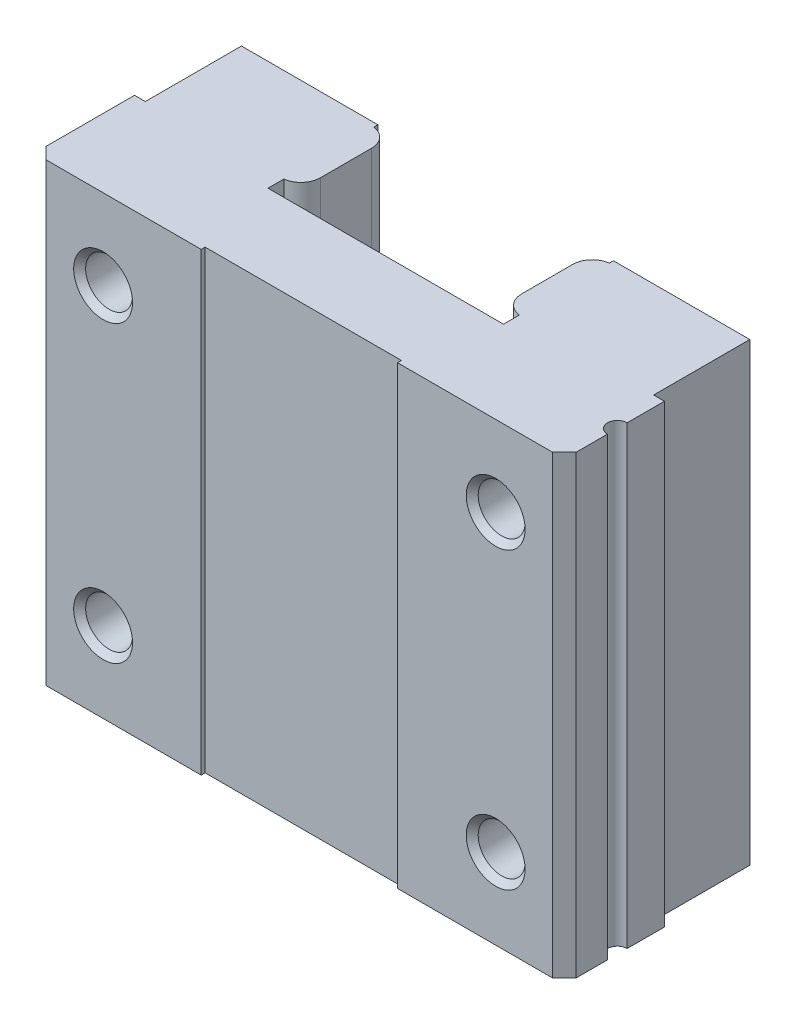
from build123d import *

# Parameters (mm, degrees)
CROQUIS1_W                    = 27
CROQUIS1_H                    = 23.199
SALIENTE_EXTRUIR1_DEPTH       = 10
CORTAR_EXTRUIR1_DEPTH         = 30.823541054
CROQUIS3_W                    = 0.55
CROQUIS3_H                    = 4.9
CORTAR_EXTRUIR2_DEPTH         = 30.823541054
CORTAR_EXTRUIR3_DEPTH         = 30.823541054
CORTAR_EXTRUIR4_DEPTH         = 23.199
CROQUIS6_W                    = 0.55
CROQUIS6_H                    = 4.9
CORTAR_EXTRUIR5_DEPTH         = 30.823541054
CROQUIS7_W                    = 10
CROQUIS7_H                    = 0.2
CORTAR_EXTRUIR6_DEPTH         = 30.823541054
DI_METRO_DE_TALADRO_1_0_1_1_D = 1
CHAFL_N1_SIZE                 = 0.305
CHAFL_N2_SIZE                 = 0.6


with BuildPart() as part:
    # Croquis1 → Saliente-Extruir1 (new body)
    with BuildSketch(Plane.XY.offset(13)):
        with Locations((0, 74.9)):
            Rectangle(CROQUIS1_W, CROQUIS1_H)
    extrude(amount=-SALIENTE_EXTRUIR1_DEPTH)

    # Croquis2 → Cortar-Extruir1 (cut, through all)
    with BuildSketch(Plane.XZ.offset(-63.3005)):
        with BuildLine():
            Line((-5.125, 3), (5.125, 3))
            Line((5.125, 3), (5.125, 6.799999997))
            ThreePointArc((5.125, 6.799999997), (5.375, 7.461437825), (6, 7.79215674))
            Line((6, 7.79215674), (6, 8.6))
            Line((6, 8.6), (-6, 8.6))
            Line((-6, 8.6), (-6, 7.79215674))
            ThreePointArc((-6, 7.79215674), (-5.375, 7.461437828), (-5.125, 6.800000001))
            Line((-5.125, 6.800000001), (-5.125, 3))
        make_face()
    extrude(amount=-CORTAR_EXTRUIR1_DEPTH, mode=Mode.SUBTRACT)

    # Croquis3 → Cortar-Extruir2 (cut, through all)
    with BuildSketch(Plane.XZ.offset(-63.3005)):
        with Locations((13.225, 5.45)):
            Rectangle(CROQUIS3_W, CROQUIS3_H)
    extrude(amount=-CORTAR_EXTRUIR2_DEPTH, mode=Mode.SUBTRACT)

    # Croquis4 → Cortar-Extruir3 (cut, through all)
    with BuildSketch(Plane.XZ.offset(-63.3005)):
        with BuildLine():
            Line((5.125, 4.199999999), (5.125, 3))
            Line((5.125, 3), (6, 3))
            Line((6, 3), (6, 3.20784326))
            ThreePointArc((6, 3.20784326), (5.375, 3.538562172), (5.125, 4.199999999))
        make_face()
    extrude(amount=-CORTAR_EXTRUIR3_DEPTH, mode=Mode.SUBTRACT)

    # Croquis5 → Cortar-Extruir4 (cut)
    with BuildSketch(Plane.XZ.offset(-63.3005)):
        with BuildLine():
            Line((-6, 3.20784326), (-6, 3))
            Line((-6, 3), (-5.125, 3))
            Line((-5.125, 3), (-5.125, 4.200000003))
            ThreePointArc((-5.125, 4.200000003), (-5.375, 3.538562175), (-6, 3.20784326))
        make_face()
    extrude(amount=-CORTAR_EXTRUIR4_DEPTH, mode=Mode.SUBTRACT)

    # Croquis6 → Cortar-Extruir5 (cut, through all)
    with BuildSketch(Plane.XZ.offset(-63.3005)):
        with Locations((-13.225, 5.45)):
            Rectangle(CROQUIS6_W, CROQUIS6_H)
    extrude(amount=-CORTAR_EXTRUIR5_DEPTH, mode=Mode.SUBTRACT)

    # Croquis7 → Cortar-Extruir6 (cut, through all)
    with BuildSketch(Plane.XZ.offset(-63.3005)):
        with Locations((0, 12.9)):
            Rectangle(CROQUIS7_W, CROQUIS7_H)
    extrude(amount=-CORTAR_EXTRUIR6_DEPTH, mode=Mode.SUBTRACT)

    # Croquis8 → Cortar-Revolución1 (revolve, cut)
    with BuildSketch(Plane.XZ.offset(-67.4), mode=Mode.PRIVATE) as cortar_revoluci_n1_sk:
        Polygon((-8.805, 13), (-10, 13), (-10, 8.307179677), (-8.8, 9), (-8.8, 9.5), (-8.805, 9.5), align=None)
    revolve(cortar_revoluci_n1_sk.sketch.rotate(Axis((-10, 67.4, 13.000025), (0, 0, -1)), 180), axis=Axis((-10, 67.4, 13.000025), (0, 0, -1)), mode=Mode.SUBTRACT)

    # Croquis9 → Cortar-Revolución2 (revolve, cut)
    with BuildSketch(Plane.XZ.offset(-82.4), mode=Mode.PRIVATE) as cortar_revoluci_n2_sk:
        Polygon((-8.805, 13), (-10, 13), (-10, 8.307179677), (-8.8, 9), (-8.8, 9.5), (-8.805, 9.5), align=None)
    revolve(cortar_revoluci_n2_sk.sketch.rotate(Axis((-10, 82.4, 13.000025), (0, 0, -1)), 180), axis=Axis((-10, 82.4, 13.000025), (0, 0, -1)), mode=Mode.SUBTRACT)

    # Croquis10 → Cortar-Revolución3 (revolve, cut)
    with BuildSketch(Plane.XZ.offset(-67.4), mode=Mode.PRIVATE) as cortar_revoluci_n3_sk:
        Polygon((11.195, 13), (10, 13), (10, 8.307179677), (11.2, 9), (11.2, 9.5), (11.195, 9.5), align=None)
    revolve(cortar_revoluci_n3_sk.sketch.rotate(Axis((10, 67.4, 13.000025), (0, 0, -1)), 180), axis=Axis((10, 67.4, 13.000025), (0, 0, -1)), mode=Mode.SUBTRACT)

    # Croquis11 → Cortar-Revolución4 (revolve, cut)
    with BuildSketch(Plane.XZ.offset(-82.4), mode=Mode.PRIVATE) as cortar_revoluci_n4_sk:
        Polygon((11.195, 13), (10, 13), (10, 8.307179677), (11.2, 9), (11.2, 9.5), (11.195, 9.5), align=None)
    revolve(cortar_revoluci_n4_sk.sketch.rotate(Axis((10, 82.4, 13.000025), (0, 0, -1)), 180), axis=Axis((10, 82.4, 13.000025), (0, 0, -1)), mode=Mode.SUBTRACT)

    # Diámetro de taladro Ø1.0 (1)1 (through all)
    with Locations(Plane(origin=(0, 86.4995, 0), x_dir=(-1, 0, 0), z_dir=(0, 1, 0))):
        with Locations((-13.5, 10.3)):
            Hole(DI_METRO_DE_TALADRO_1_0_1_1_D / 2)

    # Chaflán1
    chafl_n1_edges = [part.edges().sort_by_distance(p)[0] for p in [
        (-8.805, 67.4, 13),
        (-8.805, 82.4, 13),
        (11.195, 67.4, 13),
        (11.195, 82.4, 13),
    ]]
    chamfer(chafl_n1_edges, length=CHAFL_N1_SIZE)

    # Chaflán2
    chafl_n2_edges = [part.edges().sort_by_distance(p)[0] for p in [
        (13.5, 74.9, 13),
        (-13.5, 74.9, 13),
    ]]
    chamfer(chafl_n2_edges, length=CHAFL_N2_SIZE)


solid = part.part
